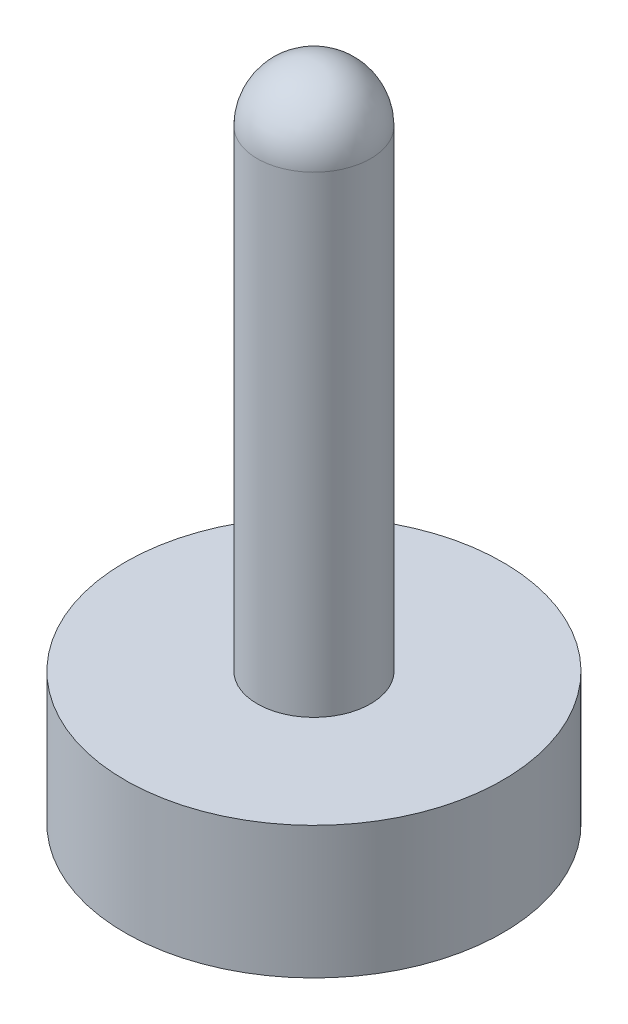
from build123d import *

# Parameters (mm, degrees)
DOME1_FACE_RADIUS = 0.6
DOME1_HEIGHT      = 0.6


with BuildPart() as part:
    # Sketch1 → Revolve1 (revolve)
    with BuildSketch(Plane.XY, mode=Mode.PRIVATE) as revolve1_sk:
        Polygon((0, 0), (2, 0), (2, 1.4), (0.6, 1.4), (0.6, 6.4), (0, 6.4), align=None)
    revolve(revolve1_sk.sketch.rotate(Axis((0, 6.4, 0), (0, -1, 0)), 180), axis=Axis((0, 6.4, 0), (0, -1, 0)))

    # Dome1: a dome of height H over a round flat face of radius A is a cap of a sphere of radius (A * A + H * H) / (2 * H)
    dome1_r = (DOME1_FACE_RADIUS * DOME1_FACE_RADIUS + DOME1_HEIGHT * DOME1_HEIGHT) / (2 * DOME1_HEIGHT)
    dome1_base = Plane((0, 6.4, 0), z_dir=(0, 1, 0))
    with Locations(dome1_base.offset(DOME1_HEIGHT - dome1_r)):
        dome1_ball = Sphere(dome1_r, mode=Mode.PRIVATE)
    add(split(dome1_ball, bisect_by=dome1_base, keep=Keep.TOP, mode=Mode.PRIVATE))


solid = part.part
